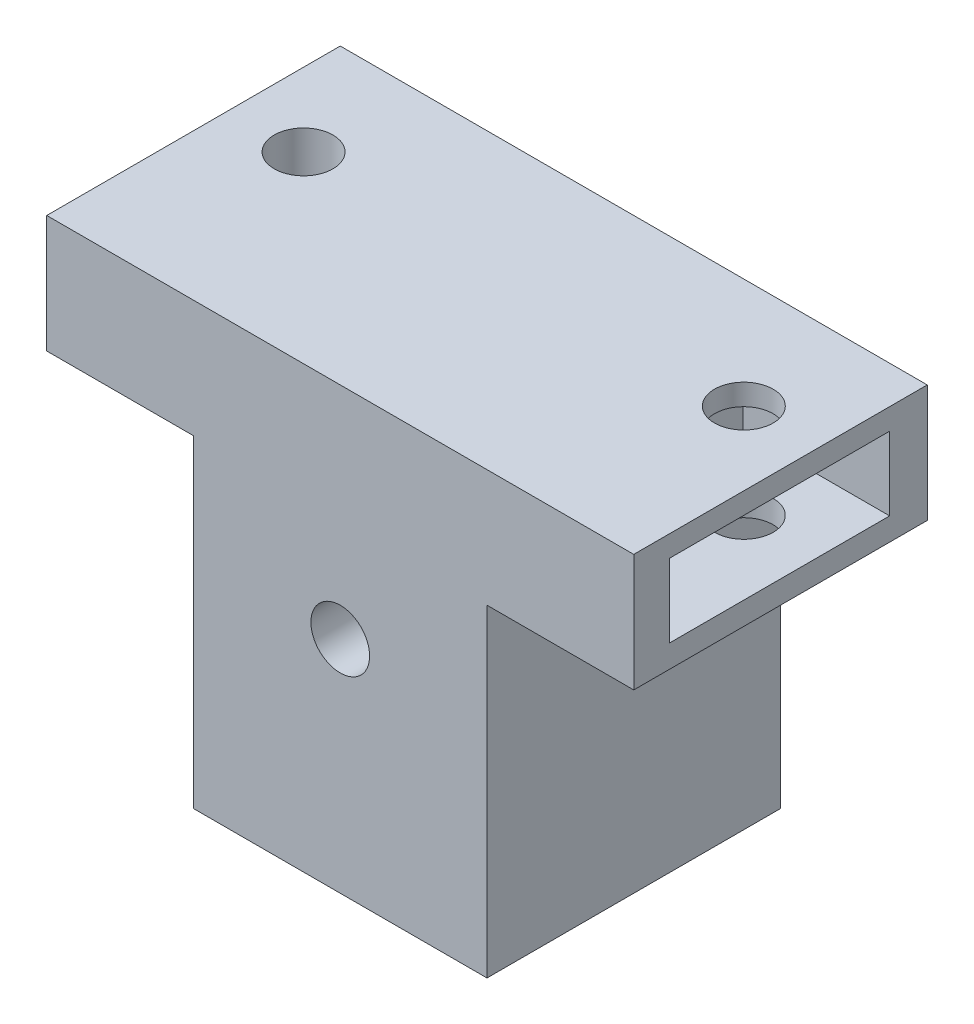
from build123d import *

# Parameters (mm, degrees)
SKETCH1_W           = 20
SKETCH1_H           = 30
BOSS_EXTRUDE1_DEPTH = 20
SKETCH2_W           = 20
SKETCH2_H           = 8
BOSS_EXTRUDE2_DEPTH = 10
SKETCH3_W           = 20
SKETCH3_H           = 8
BOSS_EXTRUDE3_DEPTH = 10
SKETCH4_R           = 2
CUT_EXTRUDE1_DEPTH  = 10
SKETCH5_R           = 6
CUT_EXTRUDE3_DEPTH  = 10
SKETCH6_R           = 2
CUT_EXTRUDE4_DEPTH  = 10
SKETCH7_W           = 15
SKETCH7_H           = 5
CUT_EXTRUDE5_DEPTH  = 10


with BuildPart() as part:
    # Sketch1 → Boss-Extrude1 (new body)
    with BuildSketch(Plane.XY):
        Rectangle(SKETCH1_W, SKETCH1_H)
    extrude(amount=BOSS_EXTRUDE1_DEPTH)

    # Sketch2 → Boss-Extrude2 (add)
    with BuildSketch(Plane.ZY.offset(10)):
        with Locations((10, 11)):
            Rectangle(SKETCH2_W, SKETCH2_H)
    extrude(amount=BOSS_EXTRUDE2_DEPTH)

    # Sketch3 → Boss-Extrude3 (add)
    with BuildSketch(Plane(origin=(10, 0, 0), x_dir=(0, 0, -1), z_dir=(1, 0, 0))):
        with Locations((-10, 11)):
            Rectangle(SKETCH3_W, SKETCH3_H)
    extrude(amount=BOSS_EXTRUDE3_DEPTH)

    # Sketch4 → Cut-Extrude1 (cut)
    with BuildSketch(Plane(origin=(0, 15, 0), x_dir=(1, 0, 0), z_dir=(0, 1, 0))):
        with Locations(Location((-15, -7.5, 0), (0, 0, 270))):
            Circle(SKETCH4_R)
        with Locations(Location((15, -7.5, 0), (0, 0, 270))):
            Circle(SKETCH4_R)
    extrude(amount=-CUT_EXTRUDE1_DEPTH, mode=Mode.SUBTRACT)

    # Sketch5 → Cut-Extrude3 (cut)
    with BuildSketch(Plane(origin=(0, 0, 0), x_dir=(-1, 0, 0), z_dir=(0, 0, -1))):
        with Locations((0, 1.296765848)):
            Circle(SKETCH5_R)
    extrude(amount=-CUT_EXTRUDE3_DEPTH, mode=Mode.SUBTRACT)

    # Sketch6 → Cut-Extrude4 (cut)
    with BuildSketch(Plane(origin=(0, 0, 10), x_dir=(-1, 0, 0), z_dir=(0, 0, -1))):
        Circle(SKETCH6_R)
    extrude(amount=-CUT_EXTRUDE4_DEPTH, mode=Mode.SUBTRACT)

    # Sketch7 → Cut-Extrude5 (cut)
    with BuildSketch(Plane(origin=(20, 0, 0), x_dir=(0, 0, -1), z_dir=(1, 0, 0))):
        with Locations((-10.063514781, 11.051610094)):
            Rectangle(SKETCH7_W, SKETCH7_H)
    extrude(amount=-CUT_EXTRUDE5_DEPTH, mode=Mode.SUBTRACT)


solid = part.part
